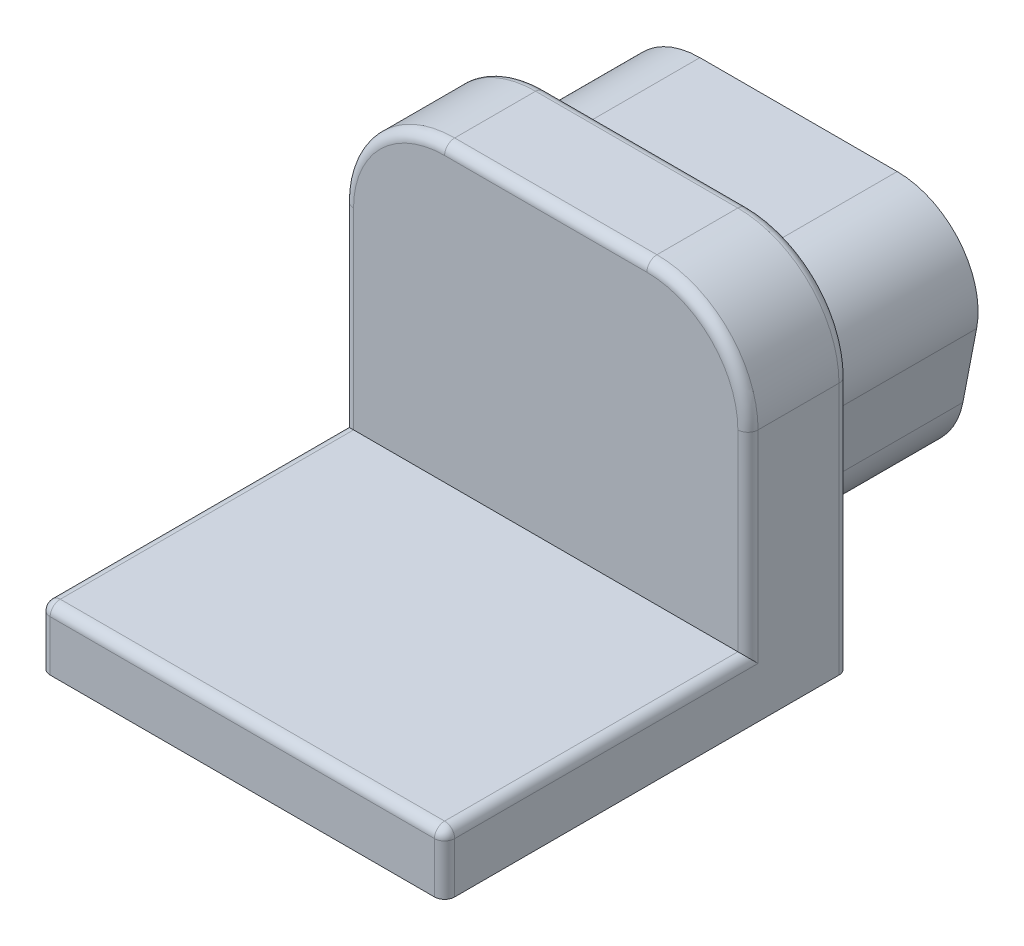
from build123d import *

# Parameters (mm, degrees)
SKETCH1_W           = 10.16
SKETCH1_H           = 10.16
BASE_EXTRUDE_DEPTH  = 8.89
BOSS_EXTRUDE1_DEPTH = 3.81
SKETCH4_R           = 0.635
CUT_EXTRUDE1_DEPTH  = 5.08
SKETCH5_R           = 0.635
CUT_EXTRUDE2_DEPTH  = 5.08
SKETCH6_R           = 0.3556
BOSS_EXTRUDE2_DEPTH = 0.254
LPATTERN1_COUNT     = 2
LPATTERN1_PITCH     = 2.7686
LPATTERN2_COUNT     = 3
LPATTERN2_PITCH     = 2.7686
LPATTERN3_COUNT     = 2
LPATTERN3_PITCH     = 2.7686
SKETCH7_R           = 0.3556
BOSS_EXTRUDE3_DEPTH = 0.254
LPATTERN4_COUNT     = 2
LPATTERN4_PITCH     = 2.7686
FILLET1_R           = 2.54
FILLET2_R           = 0.254
FILETE1_R           = 0.254
SKETCH8_W           = 17.815529842
SKETCH8_H           = 7.935766656
CUT_EXTRUDE3_DEPTH  = 7.366
FILLET3_R           = 0.254


with BuildPart() as part:
    # Sketch1 → Base-Extrude (new body)
    with BuildSketch(Plane(origin=(0, 0, 0), x_dir=(1, 0, 0), z_dir=(0, 1, 0))):
        with Locations((-5.08, 3.048)):
            Rectangle(SKETCH1_W, SKETCH1_H)
    extrude(amount=BASE_EXTRUDE_DEPTH)

    # Sketch2 → Boss-Extrude1 (add)
    with BuildSketch(Plane(origin=(0, 0, -8.128), x_dir=(-1, 0, 0), z_dir=(0, 0, -1))):
        with BuildLine():
            Line((2.946541189, 1.778), (7.213458811, 1.778))
            ThreePointArc((7.213458811, 1.778), (8.506653775, 2.24262296), (9.208462841, 3.424016944))
            Line((9.208462841, 3.424016944), (9.55246108, 5.202016944))
            ThreePointArc((9.55246108, 5.202016944), (9.12483409, 6.881194964), (7.55745705, 7.62))
            Line((7.55745705, 7.62), (2.60254295, 7.62))
            ThreePointArc((2.60254295, 7.62), (1.03516591, 6.881194964), (0.60753892, 5.202016944))
            Line((0.60753892, 5.202016944), (0.951537159, 3.424016944))
            ThreePointArc((0.951537159, 3.424016944), (1.653346225, 2.24262296), (2.946541189, 1.778))
        make_face()
    extrude(amount=BOSS_EXTRUDE1_DEPTH)

    # Sketch4 → Cut-Extrude1 (cut)
    with BuildSketch(Plane(origin=(0, 0, -11.938), x_dir=(-1, 0, 0), z_dir=(0, 0, -1))):
        with Locations((7.874, 5.842)):
            Circle(SKETCH4_R)
    cut_extrude1 = extrude(amount=-CUT_EXTRUDE1_DEPTH, mode=Mode.SUBTRACT)

    # Sketch5 → Cut-Extrude2 (cut)
    with BuildSketch(Plane(origin=(0, 0, -11.938), x_dir=(-1, 0, 0), z_dir=(0, 0, -1))):
        with Locations((6.477, 3.302)):
            Circle(SKETCH5_R)
    cut_extrude2 = extrude(amount=-CUT_EXTRUDE2_DEPTH, mode=Mode.SUBTRACT)

    # Sketch6 → Boss-Extrude2 (add)
    with BuildSketch(Plane.XZ):
        with Locations(Location((-5.08, 0, 0), (0, 0, 270))):
            Circle(SKETCH6_R)
    boss_extrude2 = extrude(amount=BOSS_EXTRUDE2_DEPTH)

    # LPattern1: Boss-Extrude2 ×2
    with Locations(*[(i * LPATTERN1_PITCH, 0, 0) for i in range(1, LPATTERN1_COUNT)]):
        add(boss_extrude2)

    # LPattern2: Cut-Extrude1 ×3
    with Locations(*[(i * LPATTERN2_PITCH, 0, 0) for i in range(1, LPATTERN2_COUNT)]):
        add(cut_extrude1, mode=Mode.SUBTRACT)

    # LPattern3: Cut-Extrude2 ×2
    with Locations(*[(i * LPATTERN3_PITCH, 0, 0) for i in range(1, LPATTERN3_COUNT)]):
        add(cut_extrude2, mode=Mode.SUBTRACT)

    # Sketch7 → Boss-Extrude3 (add)
    with BuildSketch(Plane.XZ):
        with Locations(Location((-5.08, -2.54, 0), (0, 0, 270))):
            Circle(SKETCH7_R)
    boss_extrude3 = extrude(amount=BOSS_EXTRUDE3_DEPTH)

    # LPattern4: Boss-Extrude3 ×2
    with Locations(*[(i * LPATTERN4_PITCH, 0, 0) for i in range(1, LPATTERN4_COUNT)]):
        add(boss_extrude3)

    # Fillet1
    fillet1_edges = [part.edges().sort_by_distance(p)[0] for p in [
        (-10.16, 8.89, -3.048),
        (0, 8.89, -3.048),
    ]]
    fillet(fillet1_edges, radius=FILLET1_R)

    # Fillet2
    fillet2_edges = [part.edges().sort_by_distance(p)[0] for p in [
        (-5.08, 8.89, -8.128),
        (-10.16, 3.175, -8.128),
        (0, 3.175, -8.128),
        (-0.743948776, 8.146051224, -8.128),
        (-9.416051224, 8.146051224, -8.128),
    ]]
    fillet(fillet2_edges, radius=FILLET2_R)

    # Filete1
    filete1_edges = [part.edges().sort_by_distance(p)[0] for p in [
        (-7.239, 5.842, -11.938),
        (-5.842, 3.302, -11.938),
        (-4.4704, 5.842, -11.938),
        (-1.7018, 5.842, -11.938),
        (-3.0734, 3.302, -11.938),
    ]]
    fillet(filete1_edges, radius=FILETE1_R)

    # Sketch8 → Cut-Extrude3 (cut)
    with BuildSketch(Plane(origin=(0, 8.89, 0), x_dir=(1, 0, 0), z_dir=(0, 1, 0))):
        with Locations((-3.676849553, 1.620116672)):
            Rectangle(SKETCH8_W, SKETCH8_H)
    extrude(amount=-CUT_EXTRUDE3_DEPTH, mode=Mode.SUBTRACT)

    # Fillet3
    fillet3_edges = [part.edges().sort_by_distance(p)[0] for p in [
        (-0.743948776, 8.146051224, -5.588),
        (-10.16, 0.762, 2.032),
        (0, 0.762, 2.032),
        (-5.08, 1.524, 2.032),
        (-10.16, 3.937, -5.588),
        (0, 3.937, -5.588),
        (-9.416051224, 8.146051224, -5.588),
        (0, 1.524, -1.778),
        (-10.16, 1.524, -1.778),
        (-5.08, 8.89, -5.588),
    ]]
    fillet(fillet3_edges, radius=FILLET3_R)


solid = part.part
